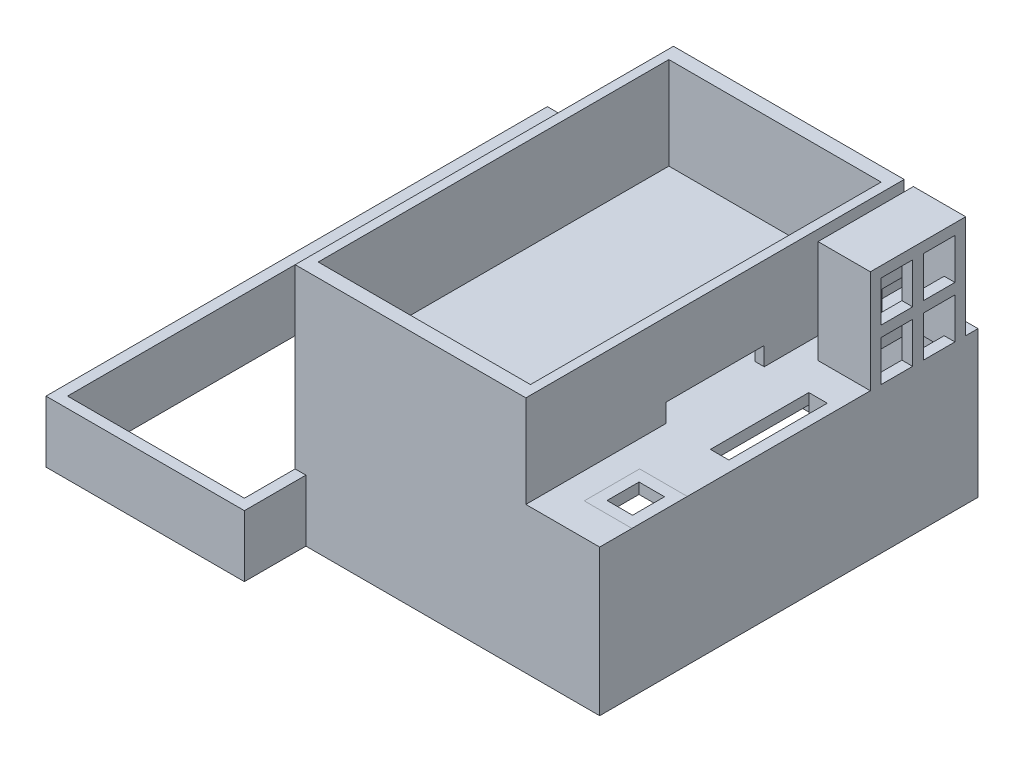
from build123d import *

# Parameters (mm, degrees)
SKETCH1_W               = 49.5
SKETCH1_H               = 61.5
BOSS_EXTRUDE1_DEPTH     = 23.75
SKETCH2_W               = 46
SKETCH2_H               = 58
CUT_EXTRUDE1_DEPTH      = 22
SKETCH3_W               = 3
SKETCH3_H               = 16
CUT_EXTRUDE2_DEPTH      = 1.75
SKETCH7_W               = 3
SKETCH7_H               = 5
BOSS_EXTRUDE2_DEPTH     = 4
SKETCH11_W              = 37.5
SKETCH11_H              = 61.5
BOSS_EXTRUDE3_DEPTH     = 15
SKETCH12_W              = 34.5
SKETCH12_H              = 57
CUT_EXTRUDE3_DEPTH      = 15
SKETCH14_W              = 7.75
SKETCH14_H              = 9
BOSS_EXTRUDE4_DEPTH     = 0.0001
SKETCH15_W              = 4.15
SKETCH15_H              = 5.2
CUT_EXTRUDE4_DEPTH      = 4.75
SKETCH16_W              = 8.5
SKETCH16_H              = 15.5
BOSS_EXTRUDE5_DEPTH     = 16.75
SKETCH17_W              = 5.125
SKETCH17_H              = 6.625
CUT_EXTRUDE5_DEPTH      = 8.5
CUT_EXTRUDE6_DEPTH      = 15
CUT_EXTRUDE6_DEPTH_BACK = 1.75
SKETCH18_W              = 5
SKETCH18_H              = 12
SKETCH20_W              = 16
SKETCH20_H              = 3
CUT_EXTRUDE7_DEPTH      = 1.75
SKETCH21_W              = 32.25
SKETCH21_H              = 81.5
BOSS_EXTRUDE7_DEPTH     = 10
SKETCH23_W              = 28.75
SKETCH23_H              = 78
CUT_EXTRUDE8_DEPTH      = 10
SKETCH25_W              = 3
SKETCH25_H              = 5.4
BOSS_EXTRUDE8_DEPTH     = 1.75
SKETCH28_W              = 3
SKETCH28_H              = 2
BOSS_EXTRUDE9_DEPTH     = 1.75


with BuildPart() as part:
    # Sketch1 → Boss-Extrude1 (new body)
    with BuildSketch(Plane(origin=(0, 0, 0), x_dir=(1, 0, 0), z_dir=(0, 1, 0))):
        with Locations((-113.412024913, -45.391200727)):
            Rectangle(SKETCH1_W, SKETCH1_H)
    extrude(amount=BOSS_EXTRUDE1_DEPTH)

    # Sketch2 → Cut-Extrude1 (cut)
    with BuildSketch(Plane(origin=(0, 0, 0), x_dir=(-1, 0, 0), z_dir=(0, -1, 0))):
        with Locations((113.412024913, -45.391200727)):
            Rectangle(SKETCH2_W, SKETCH2_H)
    extrude(amount=-CUT_EXTRUDE1_DEPTH, mode=Mode.SUBTRACT)

    # Sketch3 → Cut-Extrude2 (cut)
    with BuildSketch(Plane(origin=(0, 22, 0), x_dir=(-1, 0, 0), z_dir=(0, -1, 0))):
        with Locations((91.912024913, -66.391200727)):
            Rectangle(SKETCH3_W, SKETCH3_H)
        with Locations((91.912024913, -24.391200727)):
            Rectangle(SKETCH3_W, SKETCH3_H)
        with Locations((91.912024913, -45.391200727)):
            Rectangle(SKETCH3_W, SKETCH3_H)
    extrude(amount=-CUT_EXTRUDE2_DEPTH, mode=Mode.SUBTRACT)

    # Sketch7 → Boss-Extrude2 (add)
    with BuildSketch(Plane(origin=(0, 22, 0), x_dir=(-1, 0, 0), z_dir=(0, -1, 0))):
        with Locations((91.912024913, -55.891200727)):
            Rectangle(SKETCH7_W, SKETCH7_H)
        with Locations((91.912024913, -34.891200727)):
            Rectangle(SKETCH7_W, SKETCH7_H)
    extrude(amount=BOSS_EXTRUDE2_DEPTH)

    # Sketch11 → Boss-Extrude3 (add)
    with BuildSketch(Plane(origin=(0, 23.75, 0), x_dir=(1, 0, 0), z_dir=(0, 1, 0))):
        with Locations((-119.412024913, -45.391200727)):
            Rectangle(SKETCH11_W, SKETCH11_H)
    extrude(amount=BOSS_EXTRUDE3_DEPTH)

    # Sketch12 → Cut-Extrude3 (cut)
    with BuildSketch(Plane(origin=(0, 38.75, 0), x_dir=(1, 0, 0), z_dir=(0, 1, 0))):
        with Locations((-119.412024913, -45.391200727)):
            Rectangle(SKETCH12_W, SKETCH12_H)
    extrude(amount=-CUT_EXTRUDE3_DEPTH, mode=Mode.SUBTRACT)

    # Sketch14 → Boss-Extrude4 (add)
    with BuildSketch(Plane(origin=(0, 23.75, 0), x_dir=(1, 0, 0), z_dir=(0, 1, 0))):
        with Locations((-92.542024913, -66.391200727)):
            Rectangle(SKETCH14_W, SKETCH14_H)
    extrude(amount=BOSS_EXTRUDE4_DEPTH)

    # Sketch15 → Cut-Extrude4 (cut)
    with BuildSketch(Plane(origin=(0, 23.7501, 0), x_dir=(1, 0, 0), z_dir=(0, 1, 0))):
        with Locations((-92.542024913, -66.391200727)):
            Rectangle(SKETCH15_W, SKETCH15_H)
    extrude(amount=-CUT_EXTRUDE4_DEPTH, mode=Mode.SUBTRACT)

    # Sketch16 → Boss-Extrude5 (add)
    with BuildSketch(Plane(origin=(0, 23.75, 0), x_dir=(1, 0, 0), z_dir=(0, 1, 0))):
        with Locations((-92.912024913, -24.391200727)):
            Rectangle(SKETCH16_W, SKETCH16_H)
    extrude(amount=BOSS_EXTRUDE5_DEPTH)

    # Sketch17 → Cut-Extrude5 (cut)
    with BuildSketch(Plane(origin=(-88.662024913, 0, 0), x_dir=(0, 0, -1), z_dir=(1, 0, 0))):
        with Locations((-27.828700727, 35.4375)):
            Rectangle(SKETCH17_W, SKETCH17_H)
        with Locations((-27.828700727, 27.0625)):
            Rectangle(SKETCH17_W, SKETCH17_H)
        with Locations((-20.953700727, 35.4375)):
            Rectangle(SKETCH17_W, SKETCH17_H)
        with Locations((-20.953700727, 27.0625)):
            Rectangle(SKETCH17_W, SKETCH17_H)
    extrude(amount=-CUT_EXTRUDE5_DEPTH, mode=Mode.SUBTRACT)

    # Sketch18 → Cut-Extrude6 (cut, two sides: drawn at the far end of the back side and taken through both)
    with BuildSketch(Plane(origin=(0, 23.75, 0), x_dir=(1, 0, 0), z_dir=(0, 1, 0)).offset(-CUT_EXTRUDE6_DEPTH_BACK)):
        with Locations((-92.912024913, -24.391200727)):
            Rectangle(SKETCH18_W, SKETCH18_H)
    extrude(amount=CUT_EXTRUDE6_DEPTH + CUT_EXTRUDE6_DEPTH_BACK, mode=Mode.SUBTRACT)

    # Sketch20 → Cut-Extrude7 (cut)
    with BuildSketch(Plane(origin=(-100.662024913, 0, 0), x_dir=(0, 0, -1), z_dir=(1, 0, 0))):
        with Locations((-45.391200727, 25.25)):
            Rectangle(SKETCH20_W, SKETCH20_H)
    extrude(amount=-CUT_EXTRUDE7_DEPTH, mode=Mode.SUBTRACT)

    # Sketch21 → Boss-Extrude7 (add)
    with BuildSketch(Plane(origin=(0, 0, 0), x_dir=(-1, 0, 0), z_dir=(0, -1, 0))):
        with Locations((152.537024913, -45.391200727)):
            Rectangle(SKETCH21_W, SKETCH21_H)
    extrude(amount=-BOSS_EXTRUDE7_DEPTH)

    # Sketch23 → Cut-Extrude8 (cut)
    with BuildSketch(Plane(origin=(0, 10, 0), x_dir=(1, 0, 0), z_dir=(0, 1, 0))):
        with Locations((-152.537024913, -45.391200727)):
            Rectangle(SKETCH23_W, SKETCH23_H)
    extrude(amount=-CUT_EXTRUDE8_DEPTH, mode=Mode.SUBTRACT)

    # Sketch25 → Boss-Extrude8 (add)
    with BuildSketch(Plane(origin=(0, 22, 0), x_dir=(-1, 0, 0), z_dir=(0, -1, 0))):
        with Locations((91.912024913, -61.091200727)):
            Rectangle(SKETCH25_W, SKETCH25_H)
        with Locations((91.912024913, -71.691200727)):
            Rectangle(SKETCH25_W, SKETCH25_H)
    extrude(amount=-BOSS_EXTRUDE8_DEPTH)

    # Sketch28 → Boss-Extrude9 (add)
    with BuildSketch(Plane(origin=(0, 23.75, 0), x_dir=(1, 0, 0), z_dir=(0, 1, 0))):
        with Locations((-91.912024913, -17.391200727)):
            Rectangle(SKETCH28_W, SKETCH28_H)
        with Locations((-91.912024913, -31.391200727)):
            Rectangle(SKETCH28_W, SKETCH28_H)
    extrude(amount=-BOSS_EXTRUDE9_DEPTH)


solid = part.part
